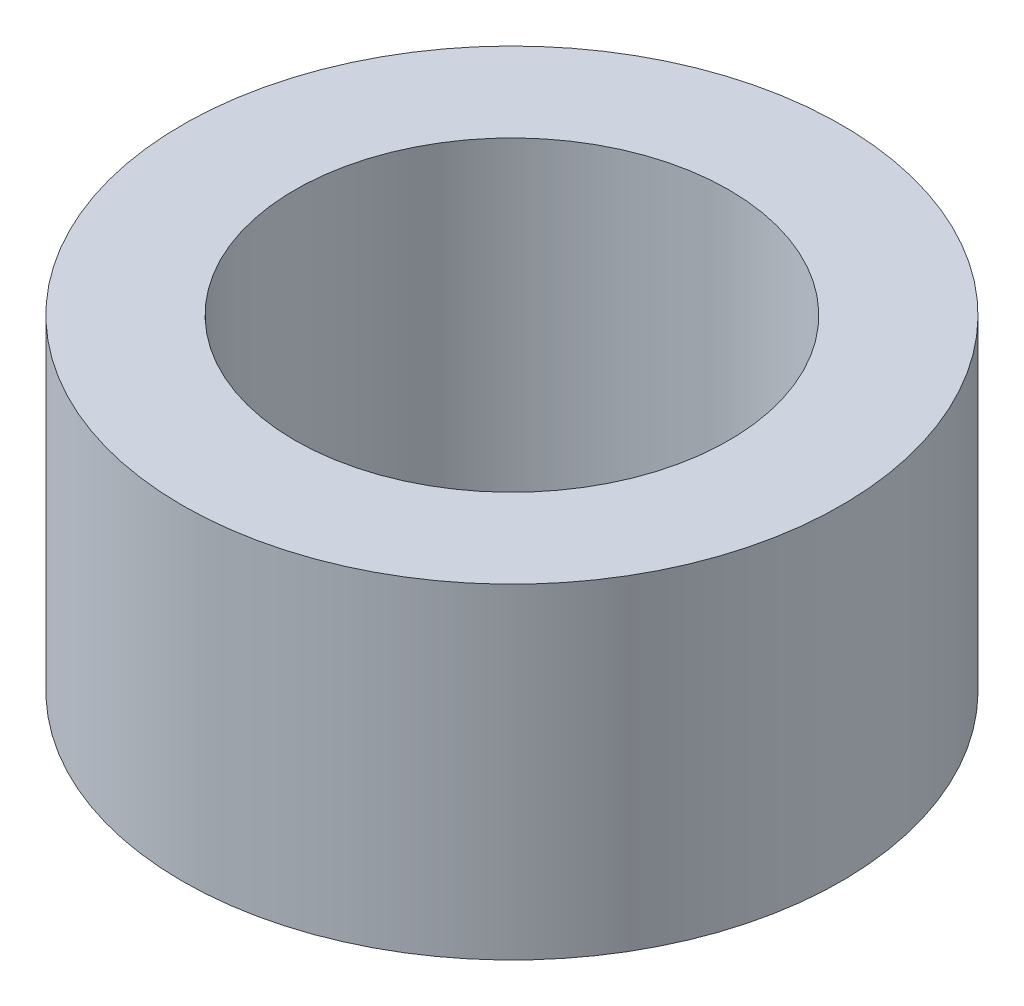
from build123d import *

# Parameters (mm, degrees)
SKETCH1_R           = 6.075
SKETCH1_R_2         = 4
BOSS_EXTRUDE1_DEPTH = 6


with BuildPart() as part:
    # Sketch1 → Boss-Extrude1 (new body)
    with BuildSketch(Plane(origin=(0, 0, 0), x_dir=(1, 0, 0), z_dir=(0, 1, 0))):
        with Locations(Location((0, 0, 0), (0, 0, 270))):
            Circle(SKETCH1_R)
        with Locations(Location((0, 0, 0), (0, 0, 270))):
            Circle(SKETCH1_R_2, mode=Mode.SUBTRACT)
    extrude(amount=BOSS_EXTRUDE1_DEPTH)


solid = part.part
